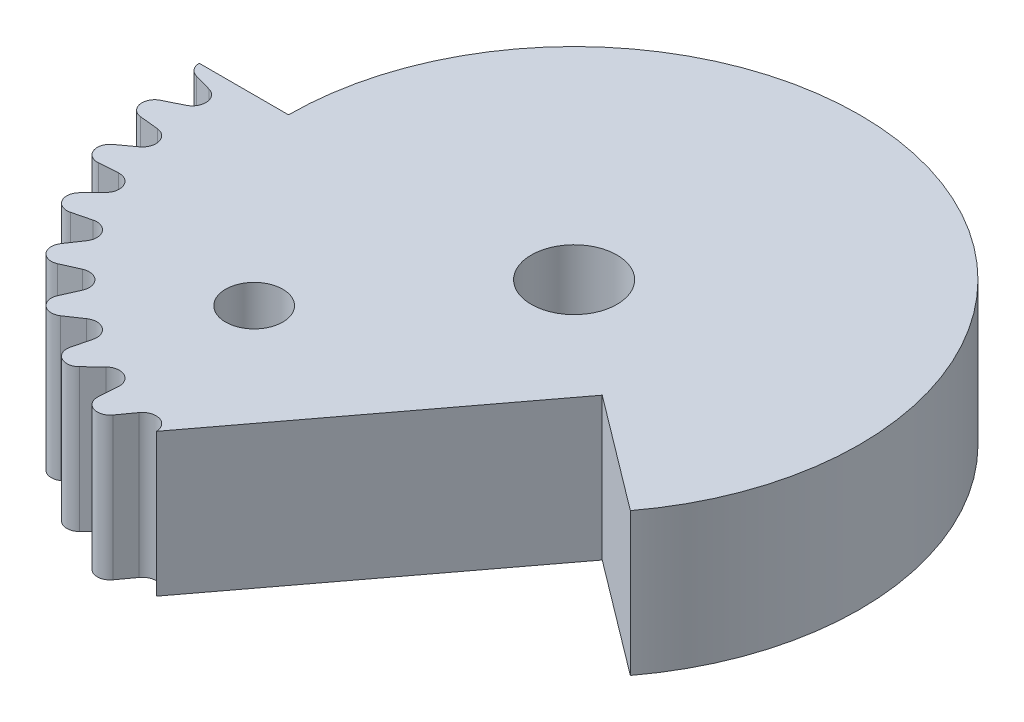
from build123d import *

# Parameters (mm, degrees)
ESQUISSE1_R        = 1
ESQUISSE1_R_2      = 1.5
BOSS_EXTRU_1_DEPTH = 5


with BuildPart() as part:
    # Esquisse1 → Boss.-Extru.1 (new body)
    with BuildSketch(Plane(origin=(0, 0, 0), x_dir=(1, 0, 0), z_dir=(0, 1, 0))):
        with BuildLine():
            Line((3.99317755, -3.009075116), (7.9863551, -6.018150232))
            ThreePointArc((7.9863551, -6.018150232), (3.173046564, 9.483236552), (-10, 0))
            Line((-10, 0), (-13.125, 0))
            ThreePointArc((-13.125, 0), (-13.034258246, -0.270986186), (-12.798628832, -0.432684541))
            Line((-12.798628832, -0.432684541), (-12.167425855, -0.613035071))
            ThreePointArc((-12.167425855, -0.613035071), (-11.81998128, -1.034114365), (-12.089027739, -1.509129635))
            Line((-12.089027739, -1.509129635), (-12.679323783, -1.796347483))
            ThreePointArc((-12.679323783, -1.796347483), (-12.925601758, -2.279132332), (-12.529054019, -2.648569664))
            Line((-12.529054019, -2.648569664), (-11.876122893, -2.716573018))
            ThreePointArc((-11.876122893, -2.716573018), (-11.46083713, -3.070922054), (-11.643310633, -3.585440202))
            Line((-11.643310633, -3.585440202), (-12.174763898, -3.970798397))
            ThreePointArc((-12.174763898, -3.970798397), (-12.333465648, -4.489014381), (-11.878790241, -4.783979338))
            Line((-11.878790241, -4.783979338), (-11.223969947, -4.737569268))
            ThreePointArc((-11.223969947, -4.737569268), (-10.753461244, -5.01442133), (-10.843817425, -5.552808982))
            Line((-10.843817425, -5.552808982), (-11.300279972, -6.024598612))
            ThreePointArc((-11.300279972, -6.024598612), (-11.366583425, -6.5625), (-10.867595431, -6.77403022))
            Line((-10.867595431, -6.77403022), (-10.230782353, -6.614616873))
            ThreePointArc((-10.230782353, -6.614616873), (-9.719346879, -6.805559951), (-9.714840312, -7.351458472))
            Line((-9.714840312, -7.351458472), (-10.082442758, -7.895344446))
            ThreePointArc((-10.082442758, -7.895344446), (-10.054333316, -8.436587377), (-9.526194234, -8.558255622))
            Line((-9.526194234, -8.558255622), (-8.926737615, -8.290682691))
            ThreePointArc((-8.926737615, -8.290682691), (-8.389915077, -8.389915077), (-8.290682691, -8.926737615))
            Line((-8.290682691, -8.926737615), (-8.558255622, -9.526194234))
            ThreePointArc((-8.558255622, -9.526194234), (-8.436587377, -10.054333316), (-7.895344446, -10.082442758))
            Line((-7.895344446, -10.082442758), (-7.351458472, -9.714840312))
            ThreePointArc((-7.351458472, -9.714840312), (-6.805559951, -9.719346879), (-6.614616873, -10.230782353))
            Line((-6.614616873, -10.230782353), (-6.77403022, -10.867595431))
            ThreePointArc((-6.77403022, -10.867595431), (-6.5625, -11.366583425), (-6.024598612, -11.300279972))
            Line((-6.024598612, -11.300279972), (-5.552808982, -10.843817425))
            ThreePointArc((-5.552808982, -10.843817425), (-5.01442133, -10.753461244), (-4.737569268, -11.223969947))
            Line((-4.737569268, -11.223969947), (-4.783979338, -11.878790241))
            ThreePointArc((-4.783979338, -11.878790241), (-4.489014381, -12.333465648), (-3.970798397, -12.174763898))
            Line((-3.970798397, -12.174763898), (-3.585440202, -11.643310633))
            ThreePointArc((-3.585440202, -11.643310633), (-3.070922054, -11.46083713), (-2.716573018, -11.876122893))
            Line((-2.716573018, -11.876122893), (-2.713178959, -11.908710794))
            Line((-2.713178959, -11.908710794), (3.99317755, -3.009075116))
        make_face()
        with Locations(Location((-4.814520185, -6.38908408, 0), (0, 0, 270))):
            Circle(ESQUISSE1_R, mode=Mode.SUBTRACT)
        with Locations(Location((0, 0, 0), (0, 0, 270))):
            Circle(ESQUISSE1_R_2, mode=Mode.SUBTRACT)
    extrude(amount=BOSS_EXTRU_1_DEPTH)


solid = part.part
